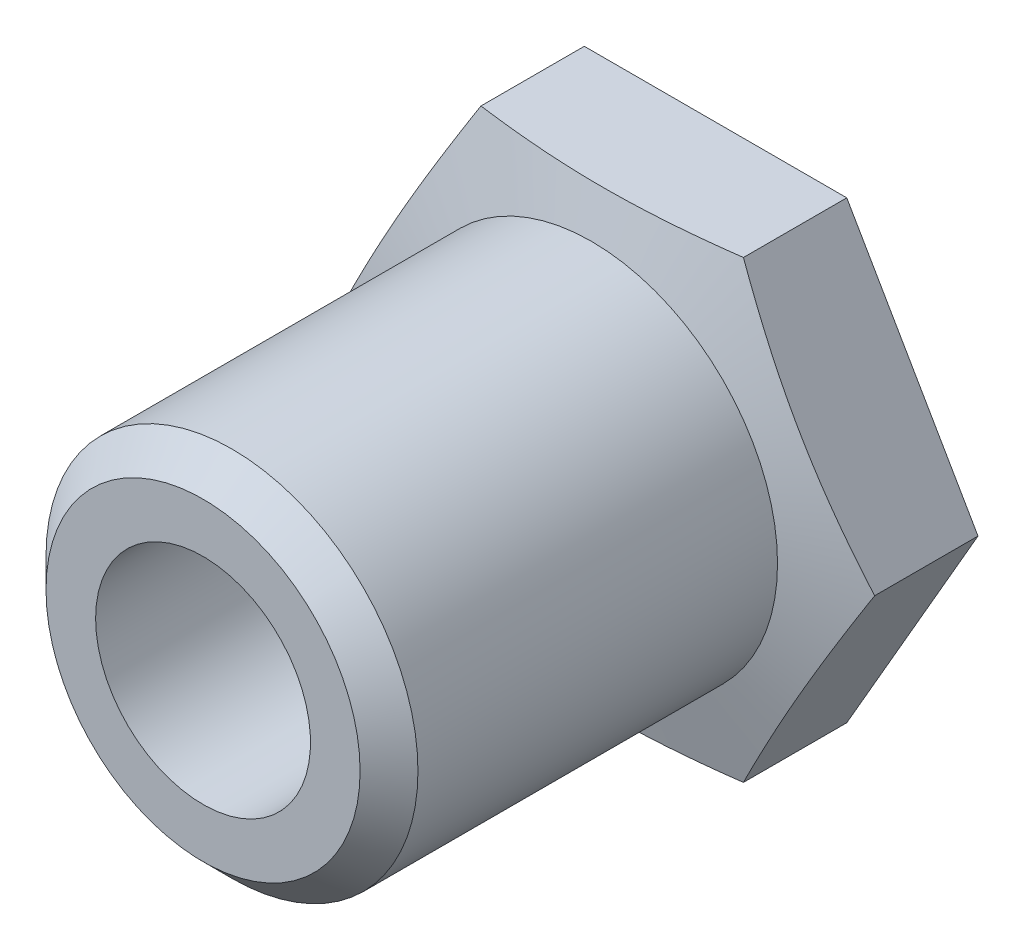
from build123d import *

# Parameters (mm, degrees)
BOSS_EXTRUDE1_DEPTH = 3
SKETCH2_R           = 4.5
BOSS_EXTRUDE2_DEPTH = 9.4
CUT_EXTRUDE1_START  = -2
SKETCH3_R           = 2.6
CUT_EXTRUDE1_DEPTH  = 13.978095117
CHAMFER2_SIZE       = 0.7


with BuildPart() as part:
    # Sketch1 → Boss-Extrude1 (new body)
    with BuildSketch(Plane.XY):
        Polygon((6.350852961, 0), (3.175426481, 5.5), (-3.175426481, 5.5), (-6.350852961, 0), (-3.175426481, -5.5), (3.175426481, -5.5), align=None)
    extrude(amount=BOSS_EXTRUDE1_DEPTH)

    # Sketch2 → Boss-Extrude2 (add)
    with BuildSketch(Plane.XY.offset(3)):
        Circle(SKETCH2_R)
    extrude(amount=BOSS_EXTRUDE2_DEPTH)

    # Sketch3 → Cut-Extrude1 (cut, through all)
    with BuildSketch(Plane(origin=(0, 0, 0), x_dir=(-1, 0, 0), z_dir=(0, 0, -1)).offset(CUT_EXTRUDE1_START)):
        Circle(SKETCH3_R)
    extrude(amount=-CUT_EXTRUDE1_DEPTH, mode=Mode.SUBTRACT)

    # Sketch5 → Cut-Revolve2 (revolve, cut)
    with BuildSketch(Plane(origin=(0, 0, 0), x_dir=(1, 0, 0), z_dir=(0, 1, 0)), mode=Mode.PRIVATE) as cut_revolve2_sk:
        Polygon((-4.5, -3), (-6.350852961, -3), (-6.350852961, -2.5), align=None)
    revolve(cut_revolve2_sk.sketch.rotate(Axis((0, 0, 12.4), (0, 0, -1)), 180), axis=Axis((0, 0, 12.4), (0, 0, -1)), mode=Mode.SUBTRACT)

    # Chamfer2
    chamfer2_edges = [part.edges().sort_by_distance(p)[0] for p in [
        (-4.5, 0, 12.4),
    ]]
    chamfer(chamfer2_edges, length=CHAMFER2_SIZE)


solid = part.part
